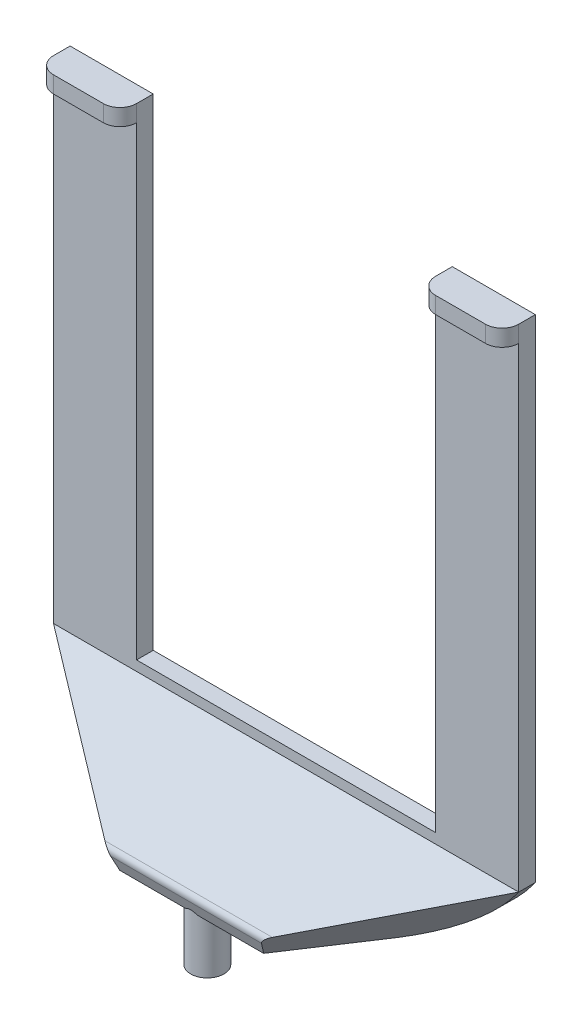
from build123d import *

# Parameters (mm, degrees)
AUFSATZ_LINEAR_AUSTRAGEN1_DEPTH      = 5
SKIZZE2_W                            = 25
SKIZZE2_H                            = 10
AUFSATZ_LINEAR_AUSTRAGEN2_DEPTH      = 5
AUFSATZ_LINEAR_AUSTRAGEN3_DEPTH      = 140
SCHNITT_LINEAR_AUSTRAGEN1_DEPTH      = 20
SKIZZE6_R                            = 5
AUFSATZ_LINEAR_AUSTRAGEN4_DEPTH      = 20
SCHNITT_LINEAR_AUSTRAGEN2_DEPTH      = 5
SCHNITT_LINEAR_AUSTRAGEN3_DEPTH      = 20
SCHNITT_LINEAR_AUSTRAGEN3_DEPTH_BACK = 5
VERRUNDUNG2_R                        = 2


with BuildPart() as part:
    # Skizze1 → Aufsatz-Linear austragen1 (new body)
    with BuildSketch(Plane.XY):
        Polygon((-91.355950116, 49.166666667), (-66.355950116, 49.166666667), (-66.355950116, -90.833333333), (23.644049884, -90.833333333), (23.644049884, 49.166666667), (48.644049884, 49.166666667), (48.644049884, -90.833333333), (48.644049884, -105.833333333), (-91.355950116, -105.833333333), (-91.355950116, -90.833333333), align=None)
    extrude(amount=AUFSATZ_LINEAR_AUSTRAGEN1_DEPTH)

    # Skizze2 → Aufsatz-Linear austragen2 (add)
    with BuildSketch(Plane(origin=(0, 49.166666667, 0), x_dir=(1, 0, 0), z_dir=(0, 1, 0))):
        with Locations((-78.855950116, -5)):
            Rectangle(SKIZZE2_W, SKIZZE2_H)
        with Locations((36.144049884, -5)):
            Rectangle(SKIZZE2_W, SKIZZE2_H)
    extrude(amount=AUFSATZ_LINEAR_AUSTRAGEN2_DEPTH)

    # Skizze4 → Aufsatz-Linear austragen3 (add)
    with BuildSketch(Plane.ZY.offset(91.355950116)):
        Polygon((0, -105.833333333), (33.429341034, -119.769048128), (35.715469601, -114.285025769), (5, -93.839208336), align=None)
    extrude(amount=-AUFSATZ_LINEAR_AUSTRAGEN3_DEPTH)

    # Skizze5 → Schnitt-Linear austragen1 (cut)
    with BuildSketch(Plane(origin=(0, -62.72011839, -41.749779724), x_dir=(1, 0, 0), z_dir=(0, 0.8324398810994642, 0.5541153709789236))):
        Polygon((-91.355950116, -56.159947145), (-41.355950116, -95.491404119), (-91.355950116, -95.491404119), align=None)
        Polygon((48.644049884, -56.159947145), (-1.355950116, -95.491404119), (48.644049884, -95.491404119), align=None)
    extrude(amount=-SCHNITT_LINEAR_AUSTRAGEN1_DEPTH, mode=Mode.SUBTRACT)

    # Skizze6 → Aufsatz-Linear austragen4 (add)
    with BuildSketch(Plane(origin=(0, -115.833333333, 0), x_dir=(1, 0, 0), z_dir=(0, 1, 0))):
        with Locations(Location((-21.355950116, -28.715469601, 0), (0, 0, 180))):
            Circle(SKIZZE6_R)
    extrude(amount=-AUFSATZ_LINEAR_AUSTRAGEN4_DEPTH)

    # Skizze7 → Schnitt-Linear austragen2 (cut)
    with BuildSketch(Plane(origin=(0, 54.166666667, 0), x_dir=(1, 0, 0), z_dir=(0, 1, 0))):
        with BuildLine():
            Line((-91.355950116, -5), (-91.355950116, -10))
            Line((-91.355950116, -10), (-86.355950638, -10))
            ThreePointArc((-86.355950638, -10), (-89.891484175, -8.535533537), (-91.355950116, -5))
        make_face()
        with BuildLine():
            Line((-71.355949595, -10), (-66.355950116, -10))
            Line((-66.355950116, -10), (-66.355950116, -5))
            ThreePointArc((-66.355950116, -5), (-67.820416058, -8.535533537), (-71.355949595, -10))
        make_face()
        with BuildLine():
            Line((23.644049884, -5), (23.644049884, -10))
            Line((23.644049884, -10), (28.644049362, -10))
            ThreePointArc((28.644049362, -10), (25.108515825, -8.535533537), (23.644049884, -5))
        make_face()
        with BuildLine():
            Line((48.644049884, -5), (48.644049884, -10))
            Line((48.644049884, -10), (43.644050405, -10))
            ThreePointArc((43.644050405, -10), (47.179583942, -8.535533537), (48.644049884, -5))
        make_face()
    extrude(amount=-SCHNITT_LINEAR_AUSTRAGEN2_DEPTH, mode=Mode.SUBTRACT)

    # Skizze8 → Schnitt-Linear austragen3 (cut, two sides: drawn at the far end of the back side and taken through both)
    with BuildSketch(Plane.XY.offset(5).offset(-SCHNITT_LINEAR_AUSTRAGEN3_DEPTH_BACK)):
        with BuildLine():
            Line((-91.355950116, -93.839208336), (-91.355950116, -112.568670939))
            Line((-91.355950116, -112.568670939), (-66.355950116, -112.568670939))
            ThreePointArc((-66.355950116, -112.568670939), (-80.35614887, -105.206397991), (-91.355950116, -93.839208336))
        make_face()
        with BuildLine():
            Line((48.644049884, -112.568670939), (23.644049884, -112.568670939))
            ThreePointArc((23.644049884, -112.568670939), (37.644248637, -105.206397991), (48.644049884, -93.839208336))
            Line((48.644049884, -93.839208336), (48.644049884, -112.568670939))
        make_face()
    extrude(amount=SCHNITT_LINEAR_AUSTRAGEN3_DEPTH + SCHNITT_LINEAR_AUSTRAGEN3_DEPTH_BACK, mode=Mode.SUBTRACT)

    # Verrundung2
    verrundung2_edges = [part.edges().sort_by_distance(p)[0] for p in [
        (-21.355950116, -114.285025769, 35.715469601),
    ]]
    fillet(verrundung2_edges, radius=VERRUNDUNG2_R)


solid = part.part
